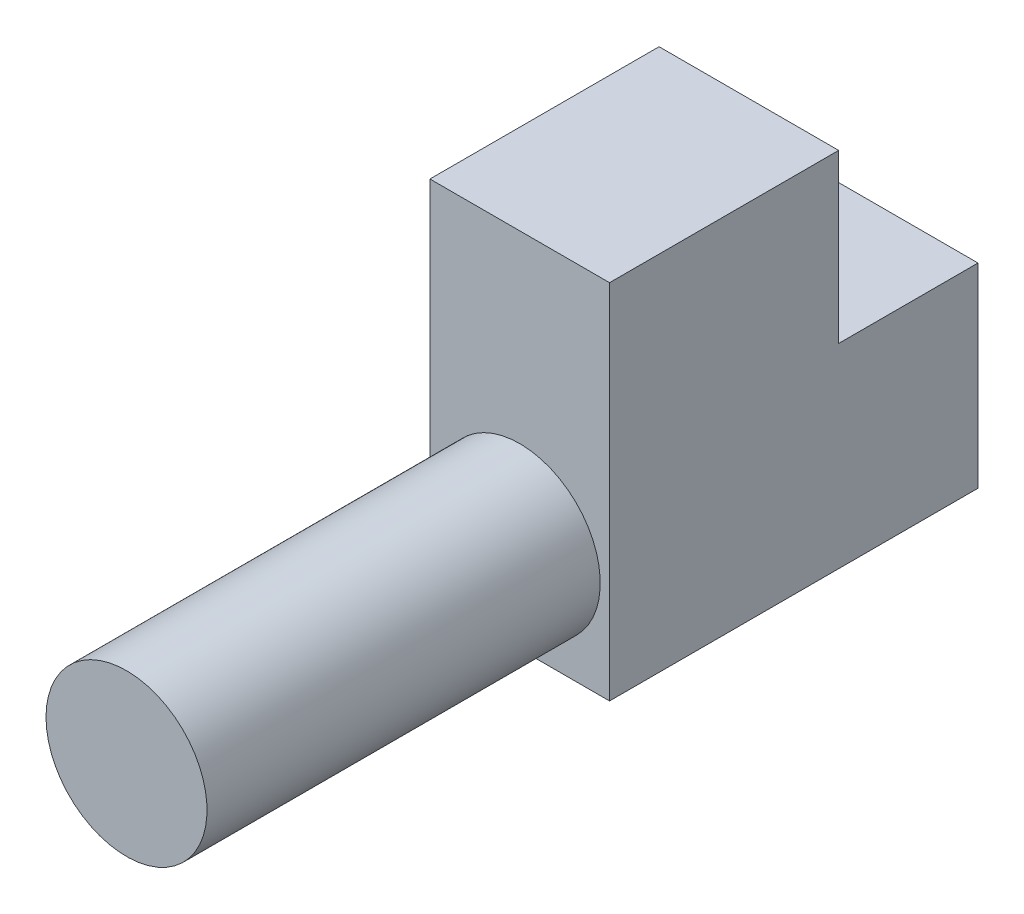
from build123d import *

# Parameters (mm, degrees)
SKETCH1_W           = 29
SKETCH1_H           = 31.5
BOSS_EXTRUDE1_DEPTH = 59.5
BOSS_EXTRUDE2_START = 15.75
SKETCH2_W           = 29
SKETCH2_H           = 37
BOSS_EXTRUDE2_DEPTH = 27
BOSS_EXTRUDE3_START = 59.5
SKETCH4_R           = 13
BOSS_EXTRUDE3_DEPTH = 63.5


with BuildPart() as part:
    # Sketch1 → Boss-Extrude1 (new body)
    with BuildSketch(Plane.XY):
        Rectangle(SKETCH1_W, SKETCH1_H)
    extrude(amount=BOSS_EXTRUDE1_DEPTH)

    # Sketch2 → Boss-Extrude2 (add)
    with BuildSketch(Plane(origin=(0, 0, 0), x_dir=(1, 0, 0), z_dir=(0, 1, 0)).offset(BOSS_EXTRUDE2_START)):
        with Locations((0, -41)):
            Rectangle(SKETCH2_W, SKETCH2_H)
    extrude(amount=BOSS_EXTRUDE2_DEPTH)

    # Sketch4 → Boss-Extrude3 (add)
    with BuildSketch(Plane.XY.offset(BOSS_EXTRUDE3_START)):
        with Locations(Location((0, 0, 0), (0, 0, 180))):
            Circle(SKETCH4_R)
    extrude(amount=BOSS_EXTRUDE3_DEPTH)


solid = part.part
